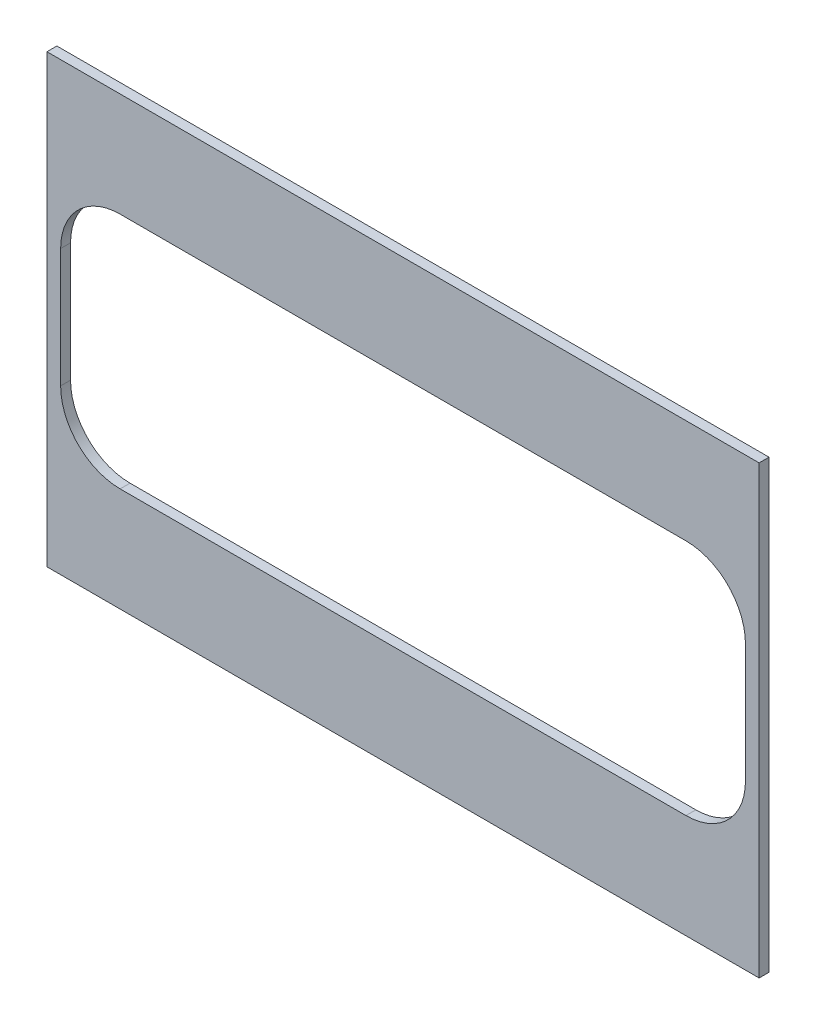
from build123d import *

# Parameters (mm, degrees)
SKETCH1_W           = 456.177532672
SKETCH1_H           = 285.75
BOSS_EXTRUDE1_DEPTH = 6.35
CUT_EXTRUDE1_REACH  = 367.675
SKETCH2_W           = 438.651532672
SKETCH2_H           = 152.4
FILLET1_R           = 38.1


with BuildPart() as part:
    # Sketch1 → Boss-Extrude1 (new body)
    with BuildSketch(Plane.XY):
        with Locations((0, -142.875)):
            Rectangle(SKETCH1_W, SKETCH1_H)
    extrude(amount=BOSS_EXTRUDE1_DEPTH)

    # Sketch2 → Cut-Extrude1 (cut, up to next)
    with BuildSketch(Plane.XY.offset(6.35), mode=Mode.PRIVATE) as cut_extrude1_sk1:
        with Locations((0, -142.875)):
            Rectangle(SKETCH2_W, SKETCH2_H)
    cut_extrude1_tool1 = extrude(cut_extrude1_sk1.sketch, amount=-CUT_EXTRUDE1_REACH, mode=Mode.PRIVATE) & part.part
    add(cut_extrude1_tool1.solids().sort_by_distance((0, -142.875, 6.35))[0], mode=Mode.SUBTRACT)

    # Fillet1
    fillet1_edges = [part.edges().sort_by_distance(p)[0] for p in [
        (219.325766336, -66.675, 3.175),
        (219.325766336, -219.075, 3.175),
        (-219.325766336, -219.075, 3.175),
        (-219.325766336, -66.675, 3.175),
    ]]
    fillet(fillet1_edges, radius=FILLET1_R)


solid = part.part
